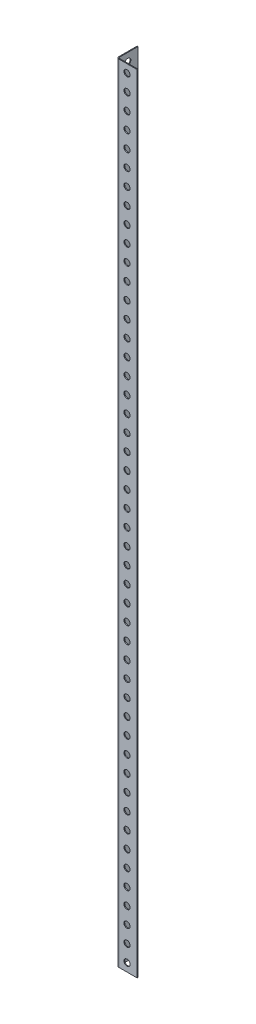
from build123d import *

# Parameters (mm, degrees)
BOSS_EXTRUDE1_DEPTH = 1219.2
SKETCH3_R           = 4.7625
CUT_EXTRUDE1_DEPTH  = 1.27
SKETCH4_R           = 4.7625
CUT_EXTRUDE2_DEPTH  = 1.27
FILLET1_R           = 3.175
FILLET2_R           = 1.5875


with BuildPart() as part:
    # Sketch1 → Boss-Extrude1 (new body)
    with BuildSketch(Plane(origin=(0, 0, 0), x_dir=(1, 0, 0), z_dir=(0, 1, 0))):
        Polygon((1.27, 1.27), (1.27, 30.48), (1.27, 31.75), (0, 31.75), (0, 0), (31.75, 0), (31.75, 1.27), (30.48, 1.27), align=None)
    extrude(amount=BOSS_EXTRUDE1_DEPTH)

    # Sketch3 → Cut-Extrude1 (cut)
    with BuildSketch(Plane.ZY):
        with Locations((-15.875, 12.7)):
            Circle(SKETCH3_R)
        with Locations((-15.875, 38.1)):
            Circle(SKETCH3_R)
        with Locations((-15.875, 63.5)):
            Circle(SKETCH3_R)
        with Locations((-15.875, 88.9)):
            Circle(SKETCH3_R)
        with Locations((-15.875, 114.3)):
            Circle(SKETCH3_R)
        with Locations((-15.875, 139.7)):
            Circle(SKETCH3_R)
        with Locations((-15.875, 165.1)):
            Circle(SKETCH3_R)
        with Locations((-15.875, 190.5)):
            Circle(SKETCH3_R)
        with Locations((-15.875, 215.9)):
            Circle(SKETCH3_R)
        with Locations((-15.875, 241.3)):
            Circle(SKETCH3_R)
        with Locations((-15.875, 266.7)):
            Circle(SKETCH3_R)
        with Locations((-15.875, 292.1)):
            Circle(SKETCH3_R)
        with Locations((-15.875, 317.5)):
            Circle(SKETCH3_R)
        with Locations((-15.875, 342.9)):
            Circle(SKETCH3_R)
        with Locations((-15.875, 368.3)):
            Circle(SKETCH3_R)
        with Locations((-15.875, 393.7)):
            Circle(SKETCH3_R)
        with Locations((-15.875, 419.1)):
            Circle(SKETCH3_R)
        with Locations((-15.875, 444.5)):
            Circle(SKETCH3_R)
        with Locations((-15.875, 469.9)):
            Circle(SKETCH3_R)
        with Locations((-15.875, 495.3)):
            Circle(SKETCH3_R)
        with Locations((-15.875, 520.7)):
            Circle(SKETCH3_R)
        with Locations((-15.875, 546.1)):
            Circle(SKETCH3_R)
        with Locations((-15.875, 571.5)):
            Circle(SKETCH3_R)
        with Locations((-15.875, 596.9)):
            Circle(SKETCH3_R)
        with Locations((-15.875, 622.3)):
            Circle(SKETCH3_R)
        with Locations((-15.875, 647.7)):
            Circle(SKETCH3_R)
        with Locations((-15.875, 673.1)):
            Circle(SKETCH3_R)
        with Locations((-15.875, 698.5)):
            Circle(SKETCH3_R)
        with Locations((-15.875, 723.9)):
            Circle(SKETCH3_R)
        with Locations((-15.875, 749.3)):
            Circle(SKETCH3_R)
        with Locations((-15.875, 774.7)):
            Circle(SKETCH3_R)
        with Locations((-15.875, 800.1)):
            Circle(SKETCH3_R)
        with Locations((-15.875, 825.5)):
            Circle(SKETCH3_R)
        with Locations((-15.875, 850.9)):
            Circle(SKETCH3_R)
        with Locations((-15.875, 876.3)):
            Circle(SKETCH3_R)
        with Locations((-15.875, 901.7)):
            Circle(SKETCH3_R)
        with Locations((-15.875, 927.1)):
            Circle(SKETCH3_R)
        with Locations((-15.875, 952.5)):
            Circle(SKETCH3_R)
        with Locations((-15.875, 977.9)):
            Circle(SKETCH3_R)
        with Locations((-15.875, 1003.3)):
            Circle(SKETCH3_R)
        with Locations((-15.875, 1028.7)):
            Circle(SKETCH3_R)
        with Locations((-15.875, 1054.1)):
            Circle(SKETCH3_R)
        with Locations((-15.875, 1079.5)):
            Circle(SKETCH3_R)
        with Locations((-15.875, 1104.9)):
            Circle(SKETCH3_R)
        with Locations((-15.875, 1130.3)):
            Circle(SKETCH3_R)
        with Locations((-15.875, 1155.7)):
            Circle(SKETCH3_R)
        with Locations((-15.875, 1181.1)):
            Circle(SKETCH3_R)
        with Locations((-15.875, 1206.5)):
            Circle(SKETCH3_R)
    extrude(amount=-CUT_EXTRUDE1_DEPTH, mode=Mode.SUBTRACT)

    # Sketch4 → Cut-Extrude2 (cut)
    with BuildSketch(Plane.XY):
        with Locations((15.875, 1206.5)):
            Circle(SKETCH4_R)
        with Locations((15.875, 1181.1)):
            Circle(SKETCH4_R)
        with Locations((15.875, 1155.7)):
            Circle(SKETCH4_R)
        with Locations((15.875, 1130.3)):
            Circle(SKETCH4_R)
        with Locations((15.875, 1104.9)):
            Circle(SKETCH4_R)
        with Locations((15.875, 1079.5)):
            Circle(SKETCH4_R)
        with Locations((15.875, 1054.1)):
            Circle(SKETCH4_R)
        with Locations((15.875, 1028.7)):
            Circle(SKETCH4_R)
        with Locations((15.875, 1003.3)):
            Circle(SKETCH4_R)
        with Locations((15.875, 977.9)):
            Circle(SKETCH4_R)
        with Locations((15.875, 952.5)):
            Circle(SKETCH4_R)
        with Locations((15.875, 927.1)):
            Circle(SKETCH4_R)
        with Locations((15.875, 901.7)):
            Circle(SKETCH4_R)
        with Locations((15.875, 876.3)):
            Circle(SKETCH4_R)
        with Locations((15.875, 850.9)):
            Circle(SKETCH4_R)
        with Locations((15.875, 825.5)):
            Circle(SKETCH4_R)
        with Locations((15.875, 800.1)):
            Circle(SKETCH4_R)
        with Locations((15.875, 774.7)):
            Circle(SKETCH4_R)
        with Locations((15.875, 749.3)):
            Circle(SKETCH4_R)
        with Locations((15.875, 723.9)):
            Circle(SKETCH4_R)
        with Locations((15.875, 698.5)):
            Circle(SKETCH4_R)
        with Locations((15.875, 673.1)):
            Circle(SKETCH4_R)
        with Locations((15.875, 647.7)):
            Circle(SKETCH4_R)
        with Locations((15.875, 622.3)):
            Circle(SKETCH4_R)
        with Locations((15.875, 596.9)):
            Circle(SKETCH4_R)
        with Locations((15.875, 571.5)):
            Circle(SKETCH4_R)
        with Locations((15.875, 546.1)):
            Circle(SKETCH4_R)
        with Locations((15.875, 520.7)):
            Circle(SKETCH4_R)
        with Locations((15.875, 495.3)):
            Circle(SKETCH4_R)
        with Locations((15.875, 469.9)):
            Circle(SKETCH4_R)
        with Locations((15.875, 444.5)):
            Circle(SKETCH4_R)
        with Locations((15.875, 419.1)):
            Circle(SKETCH4_R)
        with Locations((15.875, 393.7)):
            Circle(SKETCH4_R)
        with Locations((15.875, 368.3)):
            Circle(SKETCH4_R)
        with Locations((15.875, 342.9)):
            Circle(SKETCH4_R)
        with Locations((15.875, 317.5)):
            Circle(SKETCH4_R)
        with Locations((15.875, 292.1)):
            Circle(SKETCH4_R)
        with Locations((15.875, 266.7)):
            Circle(SKETCH4_R)
        with Locations((15.875, 241.3)):
            Circle(SKETCH4_R)
        with Locations((15.875, 215.9)):
            Circle(SKETCH4_R)
        with Locations((15.875, 190.5)):
            Circle(SKETCH4_R)
        with Locations((15.875, 165.1)):
            Circle(SKETCH4_R)
        with Locations((15.875, 139.7)):
            Circle(SKETCH4_R)
        with Locations((15.875, 114.3)):
            Circle(SKETCH4_R)
        with Locations((15.875, 88.9)):
            Circle(SKETCH4_R)
        with Locations((15.875, 63.5)):
            Circle(SKETCH4_R)
        with Locations((15.875, 38.1)):
            Circle(SKETCH4_R)
        with Locations((15.875, 12.7)):
            Circle(SKETCH4_R)
    extrude(amount=-CUT_EXTRUDE2_DEPTH, mode=Mode.SUBTRACT)

    # Fillet1
    fillet1_edges = [part.edges().sort_by_distance(p)[0] for p in [
        (0, 609.6, 0),
    ]]
    fillet(fillet1_edges, radius=FILLET1_R)

    # Fillet2
    fillet2_edges = [part.edges().sort_by_distance(p)[0] for p in [
        (1.27, 609.6, -1.27),
    ]]
    fillet(fillet2_edges, radius=FILLET2_R)


solid = part.part
